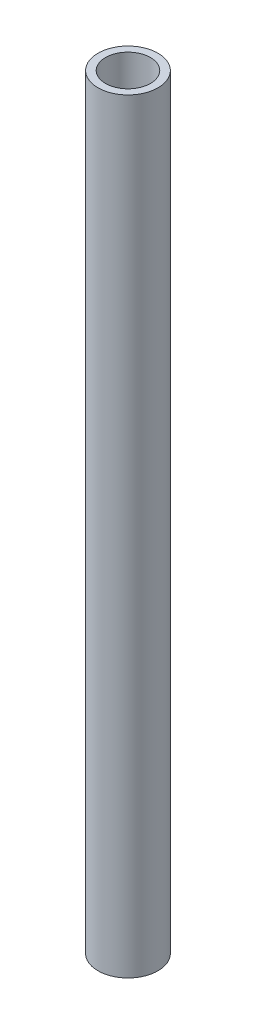
from build123d import *

# Parameters (mm, degrees)
SKETCH_1_R      = 4
SKETCH_1_R_2    = 3
EXTRUDE_1_DEPTH = 102


with BuildPart() as part:
    # Эскиз1 → Бобышка-Вытянуть1 (new body)
    with BuildSketch(Plane(origin=(0, 0, 0), x_dir=(1, 0, 0), z_dir=(0, 1, 0))):
        with Locations(Location((0, 0, 0), (0, 0, 270))):
            Circle(SKETCH_1_R)
        with Locations(Location((0, 0, 0), (0, 0, 270))):
            Circle(SKETCH_1_R_2, mode=Mode.SUBTRACT)
    extrude(amount=EXTRUDE_1_DEPTH)


solid = part.part
